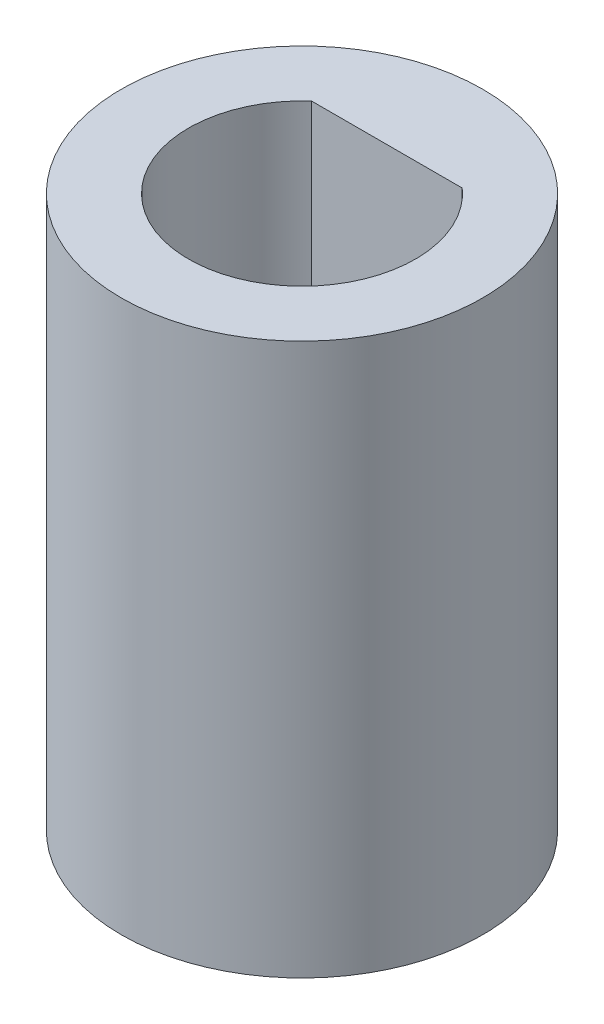
from build123d import *

# Parameters (mm, degrees)
SKETCH1_R           = 5.375
BOSS_EXTRUDE1_DEPTH = 16.4
CUT_EXTRUDE1_DEPTH  = 19.07598545


with BuildPart() as part:
    # Sketch1 → Boss-Extrude1 (new body)
    with BuildSketch(Plane(origin=(0, 0, 0), x_dir=(1, 0, 0), z_dir=(0, 1, 0))):
        Circle(SKETCH1_R)
    extrude(amount=-BOSS_EXTRUDE1_DEPTH)

    # Sketch3 → Cut-Extrude1 (cut, through all)
    with BuildSketch(Plane(origin=(0, 0, 0), x_dir=(1, 0, 0), z_dir=(0, 1, 0))):
        with BuildLine():
            Line((-2.239419568, 2.525), (2.239419568, 2.525))
            ThreePointArc((2.239419568, 2.525), (0, -3.375), (-2.239419568, 2.525))
        make_face()
    extrude(amount=-CUT_EXTRUDE1_DEPTH, mode=Mode.SUBTRACT)


solid = part.part
